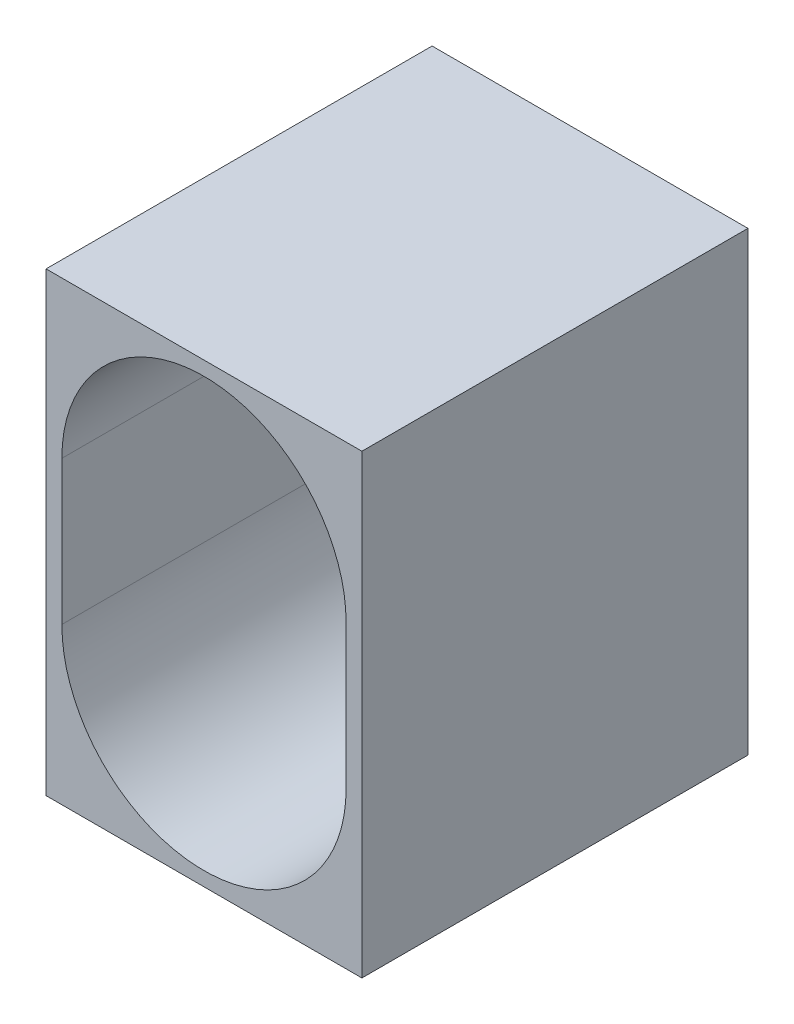
from build123d import *

# Parameters (mm, degrees)
SKETCH4_W                       = 45
SKETCH4_H                       = 65
BOSS_EXTRUDE2_DEPTH             = 55
CUT_EXTRUDE1_DEPTH              = 52.5
F_1_4_28_TAPPED_HOLE1_D         = 5.4102
TAP_DRILL_FOR_M2X0_4_TAP2_D     = 1.6
TAP_DRILL_FOR_M2X0_4_TAP2_DEPTH = 8
TAP_DRILL_FOR_M2X0_4_TAP2_TIP   = 0.480688495
TAP_DRILL_FOR_M2X0_4_TAP3_D     = 1.6
TAP_DRILL_FOR_M2X0_4_TAP3_DEPTH = 8
TAP_DRILL_FOR_M2X0_4_TAP3_TIP   = 0.480688495


with BuildPart() as part:
    # Sketch4 → Boss-Extrude2 (new body)
    with BuildSketch(Plane.XY):
        with Locations((-7.784904398, -11.939291809)):
            Rectangle(SKETCH4_W, SKETCH4_H)
    extrude(amount=BOSS_EXTRUDE2_DEPTH)

    # Sketch5 → Cut-Extrude1 (cut)
    with BuildSketch(Plane.XY.offset(55)):
        with BuildLine():
            Line((-28.034904398, -22.189291809), (-28.034904398, -1.689291809))
            ThreePointArc((-28.034904398, -1.689291809), (-7.784904398, 18.560708191), (12.465095602, -1.689291809))
            Line((12.465095602, -1.689291809), (12.465095602, -22.189291809))
            ThreePointArc((12.465095602, -22.189291809), (-7.784904398, -42.439291809), (-28.034904398, -22.189291809))
        make_face()
    extrude(amount=-CUT_EXTRUDE1_DEPTH, mode=Mode.SUBTRACT)

    # 1/4-28 Tapped Hole1 (through all)
    with Locations(Plane(origin=(0, 0, 0), x_dir=(-1, 0, 0), z_dir=(0, 0, -1))):
        with Locations((7.784904398, -16.439291809)):
            Hole(F_1_4_28_TAPPED_HOLE1_D / 2)

    # Tap Drill for M2x0.4 Tap2
    with Locations(Plane(origin=(0, 0, 0), x_dir=(-1, 0, 0), z_dir=(0, 0, -1))):
        with Locations((-10.715095602, -40.439291809)):
            Hole(TAP_DRILL_FOR_M2X0_4_TAP2_D / 2, depth=TAP_DRILL_FOR_M2X0_4_TAP2_DEPTH)
            with Locations((0, 0, -(TAP_DRILL_FOR_M2X0_4_TAP2_DEPTH + TAP_DRILL_FOR_M2X0_4_TAP2_TIP / 2))):  # 118° drill point
                Cone(0, TAP_DRILL_FOR_M2X0_4_TAP2_D / 2, TAP_DRILL_FOR_M2X0_4_TAP2_TIP, mode=Mode.SUBTRACT)

    # Tap Drill for M2x0.4 Tap3
    with Locations(Plane(origin=(-26.284904398, -40.439291809, 0), x_dir=(-1, 0, 0), z_dir=(0, 0, -1))):
        with Locations((0, 0)):
            Hole(TAP_DRILL_FOR_M2X0_4_TAP3_D / 2, depth=TAP_DRILL_FOR_M2X0_4_TAP3_DEPTH)
            with Locations((0, 0, -(TAP_DRILL_FOR_M2X0_4_TAP3_DEPTH + TAP_DRILL_FOR_M2X0_4_TAP3_TIP / 2))):  # 118° drill point
                Cone(0, TAP_DRILL_FOR_M2X0_4_TAP3_D / 2, TAP_DRILL_FOR_M2X0_4_TAP3_TIP, mode=Mode.SUBTRACT)


solid = part.part
